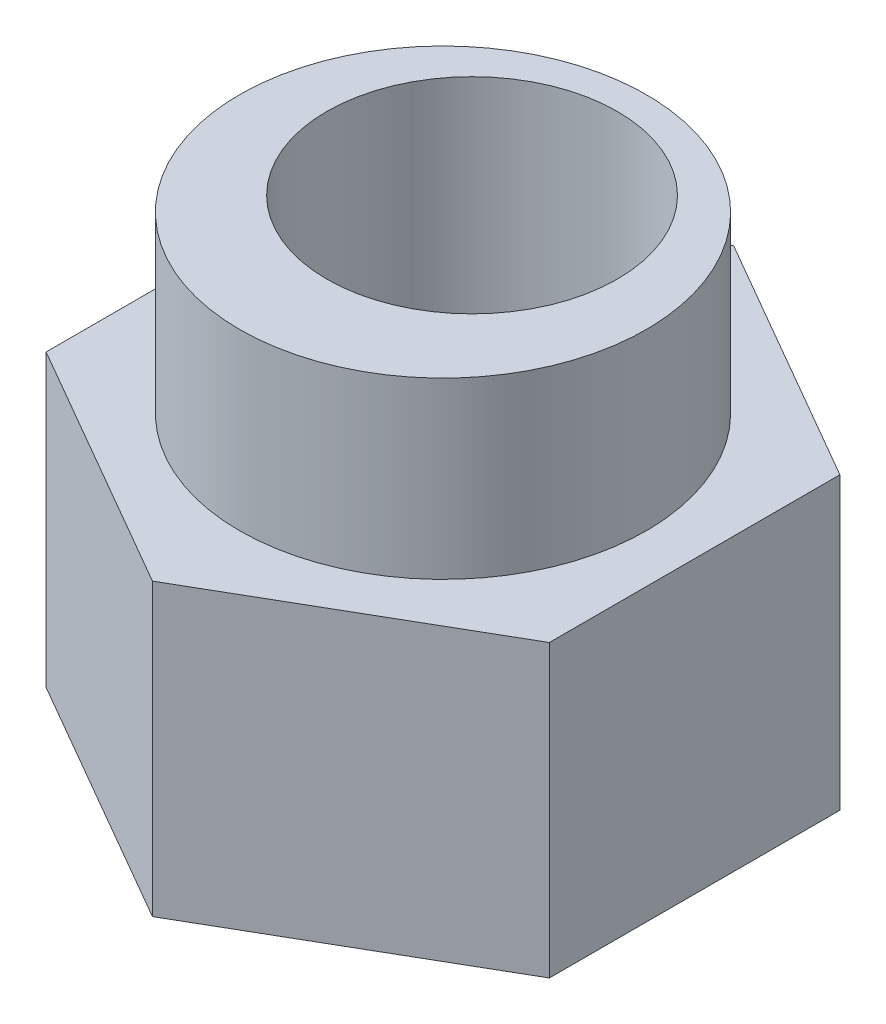
from build123d import *

# Parameters (mm, degrees)
BOSS_EXTRUDE1_DEPTH = 8
SKETCH2_R           = 2.5
CUT_EXTRUDE1_DEPTH  = 8
SKETCH3_R           = 3.5
CUT_EXTRUDE2_DEPTH  = 3


with BuildPart() as part:
    # Sketch1 → Boss-Extrude1 (new body)
    with BuildSketch(Plane(origin=(0, 0, 0), x_dir=(1, 0, 0), z_dir=(0, 1, 0))):
        Polygon((4.330127019, 2.5), (0, 5), (-4.330127019, 2.5), (-4.330127019, -2.5), (0, -5), (4.330127019, -2.5), align=None)
    extrude(amount=BOSS_EXTRUDE1_DEPTH)

    # Sketch2 → Cut-Extrude1 (cut)
    with BuildSketch(Plane(origin=(0, 8, 0), x_dir=(1, 0, 0), z_dir=(0, 1, 0))):
        with Locations(Location((0, 0.5, 0), (0, 0, 270))):
            Circle(SKETCH2_R)
    extrude(amount=-CUT_EXTRUDE1_DEPTH, mode=Mode.SUBTRACT)

    # Sketch3 → Cut-Extrude2 (cut)
    with BuildSketch(Plane(origin=(0, 8, 0), x_dir=(1, 0, 0), z_dir=(0, 1, 0))):
        Polygon((-4.330127019, 2.5), (-4.330127019, -2.5), (0, -5), (4.330127019, -2.5), (4.330127019, 2.5), (0, 5), align=None)
        with Locations(Location((0, 0, 0), (0, 0, 270))):
            Circle(SKETCH3_R, mode=Mode.SUBTRACT)
    extrude(amount=-CUT_EXTRUDE2_DEPTH, mode=Mode.SUBTRACT)


solid = part.part
